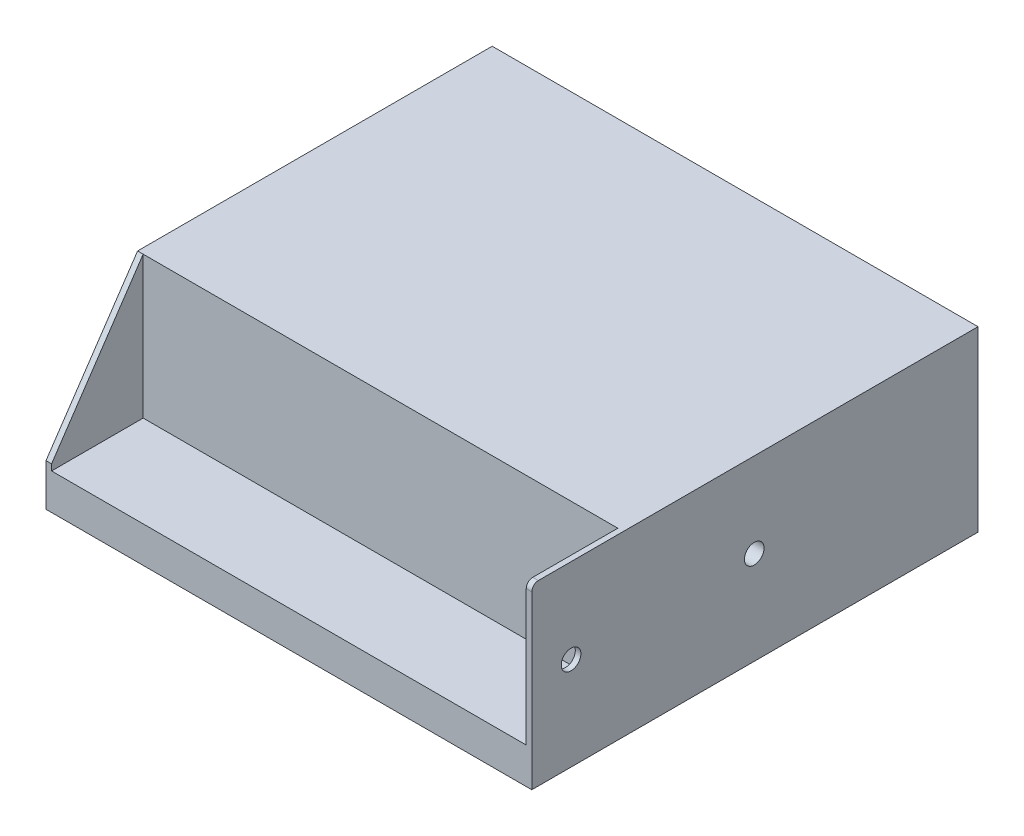
from build123d import *

# Parameters (mm, degrees)
SKETCH1_W           = 74.25
SKETCH1_H           = 68.2
BOSS_EXTRUDE1_DEPTH = 27.2
SKETCH2_R           = 1.5
CUT_EXTRUDE1_DEPTH  = 10
SKETCH3_W           = 72.55
SKETCH3_H           = 14
CUT_EXTRUDE2_DEPTH  = 21.7
CHAMFER1_SIZE       = 14
CHAMFER1_SIZE2      = 20.755853559
FILLET1_R           = 1
SKETCH4_R           = 1.5
CUT_EXTRUDE3_DEPTH  = 2


with BuildPart() as part:
    # Sketch1 → Boss-Extrude1 (new body)
    with BuildSketch(Plane(origin=(0, 0, 0), x_dir=(1, 0, 0), z_dir=(0, 1, 0))):
        Rectangle(SKETCH1_W, SKETCH1_H)
    extrude(amount=BOSS_EXTRUDE1_DEPTH)

    # Sketch2 → Cut-Extrude1 (cut)
    with BuildSketch(Plane(origin=(37.125, 0, 0), x_dir=(0, 0, -1), z_dir=(1, 0, 0))):
        with Locations((-28.1, 14.25)):
            Circle(SKETCH2_R)
        with Locations((-0.1, 14.25)):
            Circle(SKETCH2_R)
    extrude(amount=-CUT_EXTRUDE1_DEPTH, mode=Mode.SUBTRACT)

    # Sketch3 → Cut-Extrude2 (cut)
    with BuildSketch(Plane(origin=(0, 27.2, 0), x_dir=(1, 0, 0), z_dir=(0, 1, 0))):
        with Locations((0, -27.1)):
            Rectangle(SKETCH3_W, SKETCH3_H)
    extrude(amount=-CUT_EXTRUDE2_DEPTH, mode=Mode.SUBTRACT)

    # Chamfer1
    chamfer1_edges = [part.edges().sort_by_distance(p)[0] for p in [
        (-36.7, 27.2, 34.1),
    ]]
    chamfer1_side = [part.faces().sort_by_distance(p)[0] for p in [
        (0, 27.2, -6.799518298),
    ]]
    chamfer(chamfer1_edges, length=CHAMFER1_SIZE, length2=CHAMFER1_SIZE2, reference=chamfer1_side[0])

    # Fillet1
    fillet1_edges = [part.edges().sort_by_distance(p)[0] for p in [
        (36.7, 27.2, 34.1),
    ]]
    fillet(fillet1_edges, radius=FILLET1_R)

    # Sketch4 → Cut-Extrude3 (cut)
    with BuildSketch(Plane.XZ):
        with Locations(Location((0, -30.1, 0), (0, 0, 270))):
            Circle(SKETCH4_R)
        with Locations(Location((0, 19.9, 0), (0, 0, 270))):
            Circle(SKETCH4_R)
    extrude(amount=-CUT_EXTRUDE3_DEPTH, mode=Mode.SUBTRACT)


solid = part.part
